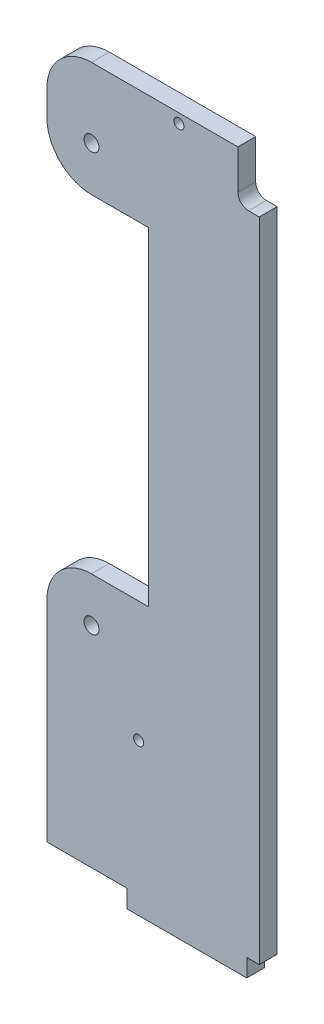
from build123d import *

# Parameters (mm, degrees)
SKETCH1_R           = 2.1
BOSS_EXTRUDE1_DEPTH = 5
SKETCH2_R           = 1.4
CUT_EXTRUDE1_DEPTH  = 145.546048026


with BuildPart() as part:
    # Sketch1 → Boss-Extrude1 (new body)
    with BuildSketch(Plane.XY):
        with BuildLine():
            Line((41, 136.6), (41, 125.6))
            ThreePointArc((41, 125.6), (41.878679656, 123.478679656), (44, 122.6))
            Line((44, 122.6), (47, 122.6))
            Line((47, 122.6), (47, -29.8))
            Line((47, -29.8), (47, -58.8))
            Line((47, -58.8), (43.5, -58.8))
            Line((43.5, -58.8), (43.5, -63.8))
            Line((43.5, -63.8), (10, -63.8))
            Line((10, -63.8), (10, -58.8))
            Line((10, -58.8), (-12.5, -58.8))
            Line((-12.5, -58.8), (-12.5, 0))
            ThreePointArc((-12.5, 0), (-8.838834765, 8.838834765), (0, 12.5))
            Line((0, 12.5), (16, 12.5))
            Line((16, 12.5), (16, 104.5))
            Line((16, 104.5), (0, 104.5))
            ThreePointArc((0, 104.5), (-8.838834765, 108.161165235), (-12.5, 117))
            Line((-12.5, 117), (-12.5, 124.1))
            ThreePointArc((-12.5, 124.1), (-8.838834765, 132.938834765), (0, 136.6))
            Line((0, 136.6), (37.5, 136.6))
            Line((37.5, 136.6), (41, 136.6))
        make_face()
        Circle(SKETCH1_R, mode=Mode.SUBTRACT)
        with Locations((0, 117)):
            Circle(SKETCH1_R, mode=Mode.SUBTRACT)
    extrude(amount=BOSS_EXTRUDE1_DEPTH)

    # Sketch2 → Cut-Extrude1 (cut, through all)
    with BuildSketch(Plane.XY.offset(5)):
        with Locations((13.2, -21.3)):
            Circle(SKETCH2_R)
        with Locations((24.5, 134)):
            Circle(SKETCH2_R)
    extrude(amount=-CUT_EXTRUDE1_DEPTH, mode=Mode.SUBTRACT)


solid = part.part
